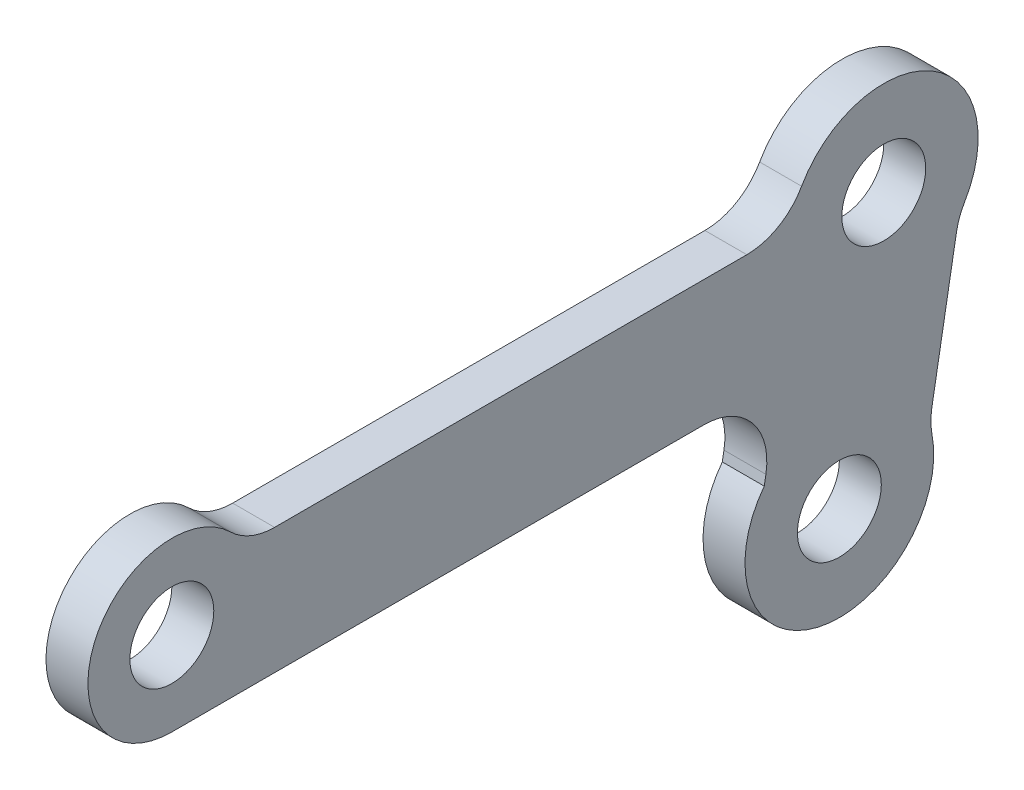
from build123d import *

# Parameters (mm, degrees)
EXTRUDE_1_DEPTH     = 2
SKETCH_1_3_R        = 2
CUT_EXTRUDE_1_DEPTH = 39.153034198
FILLET_1_R          = 3


with BuildPart() as part:
    # 草图1 → 凸台-拉伸1 (new body)
    with BuildSketch(Plane(origin=(0, 0, 0), x_dir=(0, 0, -1), z_dir=(1, 0, 0))):
        with BuildLine():
            Line((-30, -6), (-30, 0))
            Line((-30, 0), (-26.535898385, 0))
            ThreePointArc((-26.535898385, 0), (-33.464101615, 0), (-30, -6))
        make_face()
        with BuildLine():
            Line((-26.535898385, 0), (-30, 0))
            Line((-30, 0), (-30, -6))
            ThreePointArc((-30, -6), (-27.171572875, -4.828427125), (-26, -2))
            ThreePointArc((-26, -2), (-26.136296695, -0.96472382), (-26.535898385, 0))
        make_face()
        with BuildLine():
            Line((-0.506839272, 0), (-26.535898385, 0))
            ThreePointArc((-26.535898385, 0), (-26.136296695, -0.96472382), (-26, -2))
            ThreePointArc((-26, -2), (-27.171572875, -4.828427125), (-30, -6))
            Line((-30, -6), (-1.057961884, -6))
            Line((-1.057961884, -6), (-0.357984889, -2.030233193))
            ThreePointArc((-0.357984889, -2.030233193), (-0.548722311, -1.02364433), (-0.506839272, 0))
        make_face()
        with BuildLine():
            ThreePointArc((8.439231012, -0.694592711), (4.2875726, 3.791904602), (-0.506839272, 0))
            Line((-0.506839272, 0), (0, 0))
            Line((0, 0), (7.878462024, -1.389185421))
            Line((7.878462024, -1.389185421), (7.520477135, -3.419418615))
            ThreePointArc((7.520477135, -3.419418615), (8.203360909, -2.132367458), (8.439231012, -0.694592711))
        make_face()
        with BuildLine():
            Line((0, 0), (-0.506839272, 0))
            ThreePointArc((-0.506839272, 0), (-0.548722311, -1.02364433), (-0.357984889, -2.030233193))
            Line((-0.357984889, -2.030233193), (0, 0))
        make_face()
        with BuildLine():
            Line((-0.357984889, -2.030233193), (-1.057961884, -6))
            Line((-1.057961884, -6), (0, -6))
            Line((0, -6), (0, -2.870014287))
            ThreePointArc((0, -2.870014287), (-0.200342941, -2.459225106), (-0.357984889, -2.030233193))
        make_face()
        with BuildLine():
            Line((0, -6), (-1.057961884, -6))
            Line((-1.057961884, -6), (-1.757938879, -9.969766807))
            ThreePointArc((-1.757938879, -9.969766807), (2.604724043, -8.262957822), (6.120523145, -11.358952228))
            Line((6.120523145, -11.358952228), (7.520477135, -3.419418615))
            ThreePointArc((7.520477135, -3.419418615), (3.611359735, -5.182632419), (0, -2.870014287))
            Line((0, -2.870014287), (0, -6))
        make_face()
        with BuildLine():
            Line((7.878462024, -1.389185421), (0, 0))
            Line((0, 0), (0, -2.870014287))
            ThreePointArc((0, -2.870014287), (3.611359735, -5.182632419), (7.520477135, -3.419418615))
            Line((7.520477135, -3.419418615), (7.878462024, -1.389185421))
        make_face()
        with BuildLine():
            Line((0, -2.870014287), (0, 0))
            Line((0, 0), (-0.357984889, -2.030233193))
            ThreePointArc((-0.357984889, -2.030233193), (-0.200342941, -2.459225106), (0, -2.870014287))
        make_face()
        with BuildLine():
            ThreePointArc((6.120523145, -11.358952228), (2.604724043, -8.262957822), (-1.757938879, -9.969766807))
            Line((-1.757938879, -9.969766807), (-2.115923769, -12))
            Line((-2.115923769, -12), (5.762538256, -13.389185421))
            Line((5.762538256, -13.389185421), (6.120523145, -11.358952228))
        make_face()
        with BuildLine():
            Line((-2.115923769, -12), (-1.757938879, -9.969766807))
            ThreePointArc((-1.757938879, -9.969766807), (0.385532496, -16.958722607), (6.323307244, -12.694592711))
            ThreePointArc((6.323307244, -12.694592711), (6.27232239, -12.019119379), (6.120523145, -11.358952228))
            Line((6.120523145, -11.358952228), (5.762538256, -13.389185421))
            Line((5.762538256, -13.389185421), (-2.115923769, -12))
        make_face()
    extrude(amount=EXTRUDE_1_DEPTH)

    # 草图1<3> → 切除-拉伸1 (cut, through all)
    with BuildSketch(Plane(origin=(0, 0, 0), x_dir=(0, 0, -1), z_dir=(1, 0, 0))):
        with Locations((-30, -2)):
            Circle(SKETCH_1_3_R)
        with Locations((3.939231012, -0.694592711)):
            Circle(SKETCH_1_3_R)
        with Locations((1.823307244, -12.694592711)):
            Circle(SKETCH_1_3_R)
    extrude(amount=CUT_EXTRUDE_1_DEPTH, mode=Mode.SUBTRACT)

    # 圆角1
    fillet_1_edges = [part.edges().sort_by_distance(p)[0] for p in [
        (1, -11.358952228, -6.120523145),
        (1, -3.419418615, -7.520477135),
        (1, 0, 0.506839272),
        (1, 0, 26.535898385),
        (1, -6, 1.057961884),
    ]]
    fillet(fillet_1_edges, radius=FILLET_1_R)


solid = part.part
